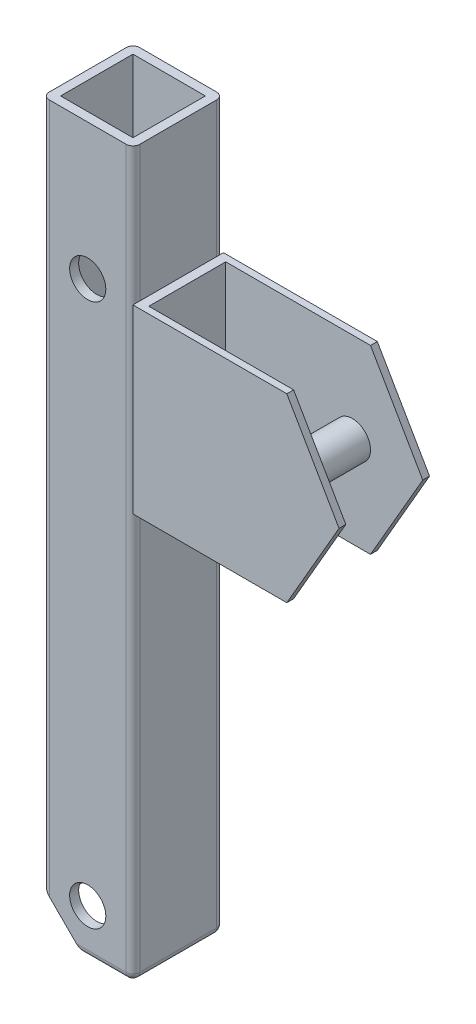
from build123d import *

# Parameters (mm, degrees)
SKETCH1_W           = 10
SKETCH1_H           = 80
BOSS_EXTRUDE1_DEPTH = 10
SHELL1_T            = -1
FILLET1_R           = 0.75
SKETCH2_W           = 8.5
SKETCH2_H           = 20
BOSS_EXTRUDE2_DEPTH = 1
SKETCH3_W           = 0.75
SKETCH3_H           = 20
BOSS_EXTRUDE3_DEPTH = 30
CUT_EXTRUDE1_DEPTH  = 35
SKETCH5_R           = 2
CUT_EXTRUDE2_DEPTH  = 35
FILLET2_R           = 0.75
SKETCH6_R           = 2
BOSS_EXTRUDE4_DEPTH = 10


with BuildPart() as part:
    # Sketch1 → Boss-Extrude1 (new body)
    with BuildSketch(Plane.XY):
        Rectangle(SKETCH1_W, SKETCH1_H)
    extrude(amount=BOSS_EXTRUDE1_DEPTH)

    # Shell1
    shell1_openings = [part.faces().sort_by_distance(p)[0] for p in [
        (0, -40, 5),
        (0, 40, 5),
    ]]
    offset(amount=SHELL1_T, openings=shell1_openings, kind=Kind.INTERSECTION)

    # Fillet1
    fillet1_edges = [part.edges().sort_by_distance(p)[0] for p in [
        (-5, 0, 10),
        (5, 0, 10),
        (-5, 0, 0),
        (5, 0, 0),
    ]]
    fillet(fillet1_edges, radius=FILLET1_R)

    # Sketch2 → Boss-Extrude2 (add)
    with BuildSketch(Plane(origin=(5, 0, 0), x_dir=(0, 0, -1), z_dir=(1, 0, 0))):
        with Locations((-5, 15)):
            Rectangle(SKETCH2_W, SKETCH2_H)
    extrude(amount=BOSS_EXTRUDE2_DEPTH)

    # Sketch3 → Boss-Extrude3 (add)
    with BuildSketch(Plane(origin=(5, 0, 0), x_dir=(0, 0, -1), z_dir=(1, 0, 0))):
        with Locations((-9.625, 15)):
            Rectangle(SKETCH3_W, SKETCH3_H)
        with Locations((-0.375, 15)):
            Rectangle(SKETCH3_W, SKETCH3_H)
    extrude(amount=BOSS_EXTRUDE3_DEPTH)

    # Sketch4 → Cut-Extrude1 (cut)
    with BuildSketch(Plane.XY.offset(10)):
        Polygon((22, 5), (35, 5), (35, 25), (22, 25), (27.773502692, 15), align=None)
    extrude(amount=-CUT_EXTRUDE1_DEPTH, mode=Mode.SUBTRACT)

    # Sketch5 → Cut-Extrude2 (cut)
    with BuildSketch(Plane.XY.offset(10)):
        with Locations((0, 25)):
            Circle(SKETCH5_R)
        with Locations((0, -35)):
            Circle(SKETCH5_R)
        Polygon((-5, -35.5), (-0.5, -40), (-5, -40), align=None)
    extrude(amount=-CUT_EXTRUDE2_DEPTH, mode=Mode.SUBTRACT)

    # Fillet2
    fillet2_edges = [part.edges().sort_by_distance(p)[0] for p in [
        (1.875, -40, 0),
        (1.875, -40, 10),
        (-0.5, -40, 9.5),
        (-0.5, -40, 0.5),
        (5, -40, 5),
        (4.780330086, -40, 0.219669914),
        (4.780330086, -40, 9.780330086),
    ]]
    fillet(fillet2_edges, radius=FILLET2_R)

    # Sketch6 → Boss-Extrude4 (add)
    with BuildSketch(Plane.XY.offset(10)):
        with Locations((20, 15)):
            Circle(SKETCH6_R)
    extrude(amount=-BOSS_EXTRUDE4_DEPTH)


solid = part.part
